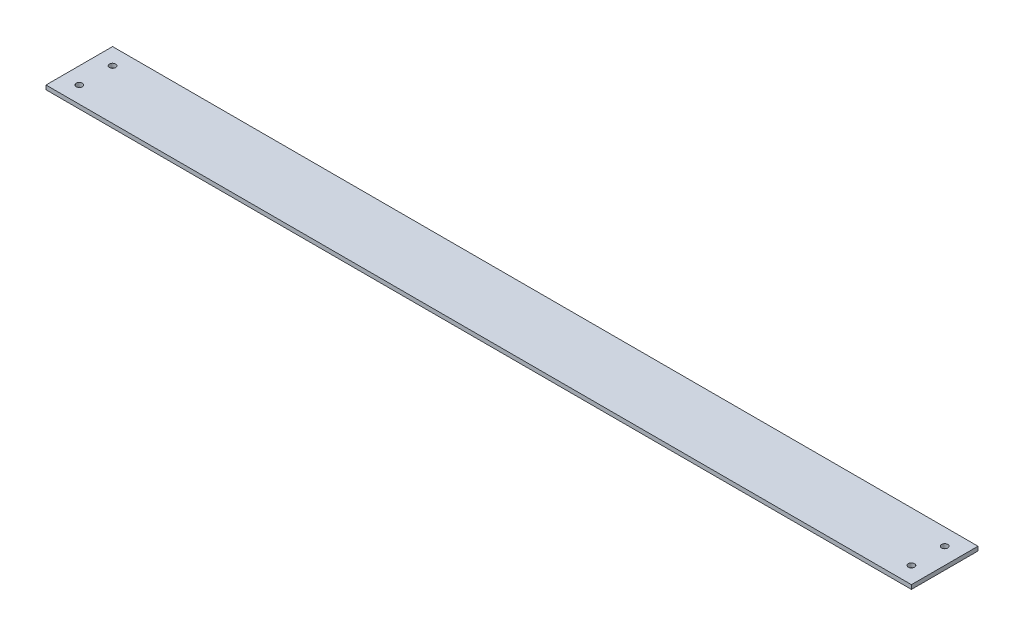
from build123d import *

# Parameters (mm, degrees)
SKETCH1_W           = 660.4
SKETCH1_H           = 50.8
SKETCH1_R           = 2.38125
BOSS_EXTRUDE1_DEPTH = 3.175


with BuildPart() as part:
    # Sketch1 → Boss-Extrude1 (new body)
    with BuildSketch(Plane(origin=(0, 0, 0), x_dir=(1, 0, 0), z_dir=(0, 1, 0))):
        Rectangle(SKETCH1_W, SKETCH1_H)
        with Locations(Location((-317.5, 12.7, 0), (0, 0, 270))):
            Circle(SKETCH1_R, mode=Mode.SUBTRACT)
        with Locations(Location((-317.5, -12.7, 0), (0, 0, 270))):
            Circle(SKETCH1_R, mode=Mode.SUBTRACT)
        with Locations(Location((317.5, -12.7, 0), (0, 0, 90))):
            Circle(SKETCH1_R, mode=Mode.SUBTRACT)
        with Locations(Location((317.5, 12.7, 0), (0, 0, 90))):
            Circle(SKETCH1_R, mode=Mode.SUBTRACT)
    extrude(amount=BOSS_EXTRUDE1_DEPTH)


solid = part.part
